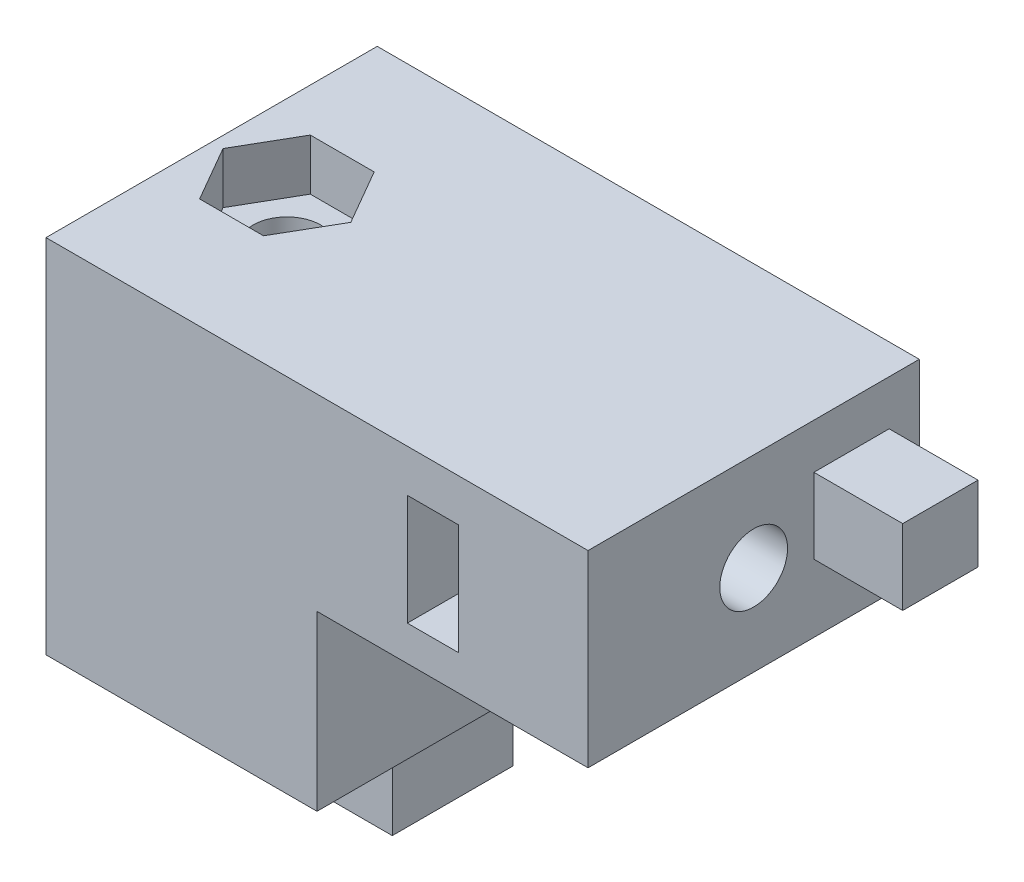
from build123d import *

# Parameters (mm, degrees)
EXTRUDE_420_DEPTH          = 22
SKETCH_473_W               = 6
SKETCH_473_H               = 8
EXTRUDE_540_DEPTH          = 5.9
SKETCH_591_W               = 5
SKETCH_591_H               = 5
EXTRUDE_711_DEPTH          = 5.9
CUT_EXTRUDE_4_DEPTH        = 54.062321849
CUT_EXTRUDE_4_DEPTH_BACK   = 54.062321849
SKETCH_4_R                 = 2.25
CUT_EXTRUDE_4_2_DEPTH      = 49.538644398
CUT_EXTRUDE_4_2_DEPTH_BACK = 49.538644398
SKETCH_4_2_R               = 2.25
CUT_EXTRUDE_4_3_DEPTH      = 3.4
CUT_EXTRUDE_4_4_DEPTH      = 54.062321849
CUT_EXTRUDE_4_4_DEPTH_BACK = 54.062321849
SKETCH_4_4_W               = 3.4
SKETCH_4_4_H               = 7.35


with BuildPart() as part:
    # Sketch 413 → Extrude 420 (new body)
    with BuildSketch(Plane.XY):
        Polygon((0, 0), (18, 0), (18, 11.5), (36, 11.5), (36, 24), (0, 24), align=None)
    extrude(amount=EXTRUDE_420_DEPTH)

    # Sketch 473 → Extrude 540 (add)
    with BuildSketch(Plane(origin=(0, 0, 0), x_dir=(1, 0, 0), z_dir=(0, 1, 0))):
        with Locations((13, -11)):
            Rectangle(SKETCH_473_W, SKETCH_473_H)
    extrude(amount=-EXTRUDE_540_DEPTH)

    # Sketch 591 → Extrude 711 (add)
    with BuildSketch(Plane(origin=(36, 0, 0), x_dir=(0, 0, -1), z_dir=(1, 0, 0))):
        with Locations((-4.5, 18.5)):
            Rectangle(SKETCH_591_W, SKETCH_591_H)
    extrude(amount=EXTRUDE_711_DEPTH)

    # Sketch 4 → Cut-Extrude 4 (cut, two sides: drawn at the far end of the back side and taken through both)
    with BuildSketch(Plane(origin=(0, 0, 0), x_dir=(1, 0, 0), z_dir=(0, 1, 0)).offset(-CUT_EXTRUDE_4_DEPTH_BACK)):
        with Locations(Location((5, -11, 0), (0, 0, 270))):
            Circle(SKETCH_4_R)
    extrude(amount=CUT_EXTRUDE_4_DEPTH + CUT_EXTRUDE_4_DEPTH_BACK, mode=Mode.SUBTRACT)

    # Sketch 4 2 → Cut-Extrude 4 2 (cut, two sides: drawn at the far end of the back side and taken through both)
    with BuildSketch(Plane(origin=(36, 0, 0), x_dir=(0, 0, -1), z_dir=(1, 0, 0)).offset(-CUT_EXTRUDE_4_2_DEPTH_BACK)):
        with Locations(Location((-11, 17.5, 0), (0, 0, 180))):
            Circle(SKETCH_4_2_R)
    extrude(amount=CUT_EXTRUDE_4_2_DEPTH + CUT_EXTRUDE_4_2_DEPTH_BACK, mode=Mode.SUBTRACT)

    # Sketch 4 3 → Cut-Extrude 4 3 (cut)
    with BuildSketch(Plane(origin=(0, 24, 0), x_dir=(1, 0, 0), z_dir=(0, 1, 0))):
        Polygon((9.243524479, -11), (7.121762239, -14.675), (2.878237761, -14.675), (0.756475521, -11), (2.878237761, -7.325), (7.121762239, -7.325), align=None)
    extrude(amount=-CUT_EXTRUDE_4_3_DEPTH, mode=Mode.SUBTRACT)

    # Sketch 4 4 → Cut-Extrude 4 4 (cut, two sides: drawn at the far end of the back side and taken through both)
    with BuildSketch(Plane.XY.offset(-CUT_EXTRUDE_4_4_DEPTH_BACK)):
        with Locations((25.7, 17.5)):
            Rectangle(SKETCH_4_4_W, SKETCH_4_4_H)
    extrude(amount=CUT_EXTRUDE_4_4_DEPTH + CUT_EXTRUDE_4_4_DEPTH_BACK, mode=Mode.SUBTRACT)


solid = part.part
